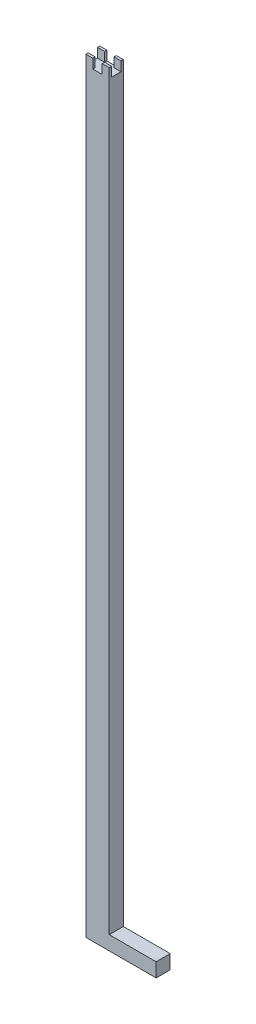
from build123d import *

# Parameters (mm, degrees)
SKETCH1_W           = 15
SKETCH1_H           = 3
BOSS_EXTRUDE1_DEPTH = 3
SKETCH2_W           = 5
SKETCH2_H           = 3
BOSS_EXTRUDE2_DEPTH = 160
CUT_EXTRUDE1_DEPTH  = 2


with BuildPart() as part:
    # Sketch1 → Boss-Extrude1 (new body)
    with BuildSketch(Plane(origin=(0, 0, 0), x_dir=(1, 0, 0), z_dir=(0, 1, 0))):
        Rectangle(SKETCH1_W, SKETCH1_H)
    extrude(amount=BOSS_EXTRUDE1_DEPTH)

    # Sketch2 → Boss-Extrude2 (add)
    with BuildSketch(Plane(origin=(0, 3, 0), x_dir=(1, 0, 0), z_dir=(0, 1, 0))):
        with Locations((-5, 0)):
            Rectangle(SKETCH2_W, SKETCH2_H)
    extrude(amount=BOSS_EXTRUDE2_DEPTH)

    # Sketch3 → Cut-Extrude1 (cut)
    with BuildSketch(Plane(origin=(0, 163, 0), x_dir=(1, 0, 0), z_dir=(0, 1, 0))):
        Polygon((-6, 1), (-7.5, 1), (-7.5, -1), (-6, -1), (-6, -1.5), (-4, -1.5), (-4, -1), (-2.5, -1), (-2.5, 1), (-4, 1), (-4, 1.5), (-6, 1.5), align=None)
    extrude(amount=-CUT_EXTRUDE1_DEPTH, mode=Mode.SUBTRACT)


solid = part.part
